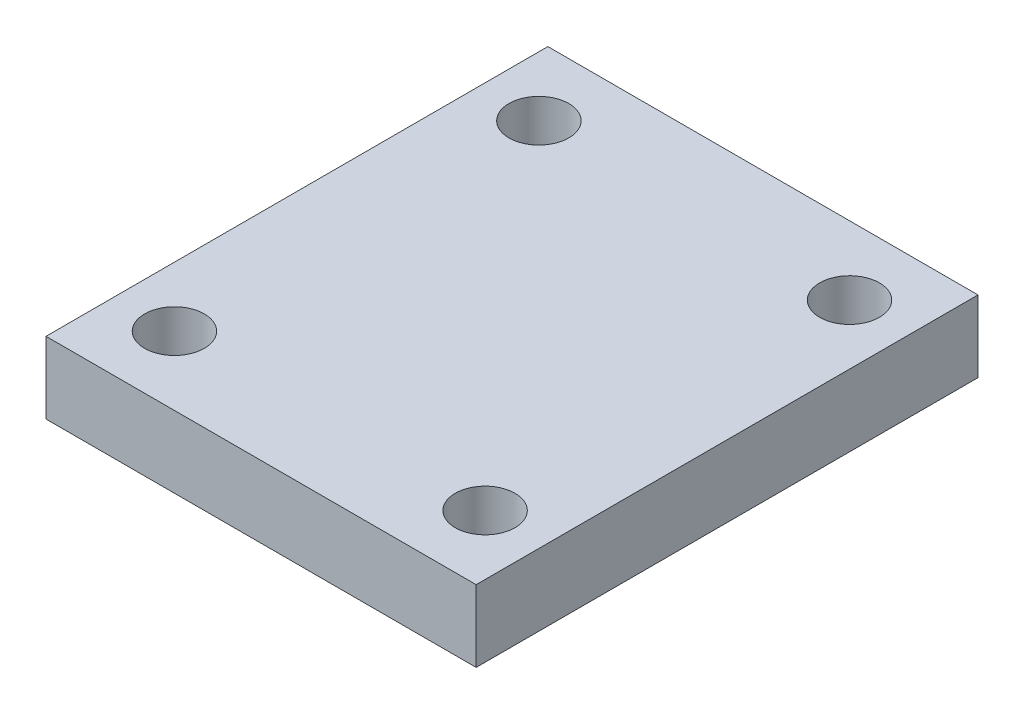
from build123d import *

# Parameters (mm, degrees)
SKETCH1_W           = 36
SKETCH1_H           = 42
SKETCH1_R           = 2.5
BOSS_EXTRUDE1_DEPTH = 6


with BuildPart() as part:
    # Sketch1 → Boss-Extrude1 (new body)
    with BuildSketch(Plane(origin=(0, 0, 0), x_dir=(1, 0, 0), z_dir=(0, 1, 0))):
        Rectangle(SKETCH1_W, SKETCH1_H)
        with Locations(Location((-13, 15.25, 0), (0, 0, 270))):
            Circle(SKETCH1_R, mode=Mode.SUBTRACT)
        with Locations(Location((-13, -15.25, 0), (0, 0, 90))):
            Circle(SKETCH1_R, mode=Mode.SUBTRACT)
        with Locations(Location((13, -15.25, 0), (0, 0, 270))):
            Circle(SKETCH1_R, mode=Mode.SUBTRACT)
        with Locations(Location((13, 15.25, 0), (0, 0, 90))):
            Circle(SKETCH1_R, mode=Mode.SUBTRACT)
    extrude(amount=BOSS_EXTRUDE1_DEPTH)


solid = part.part
